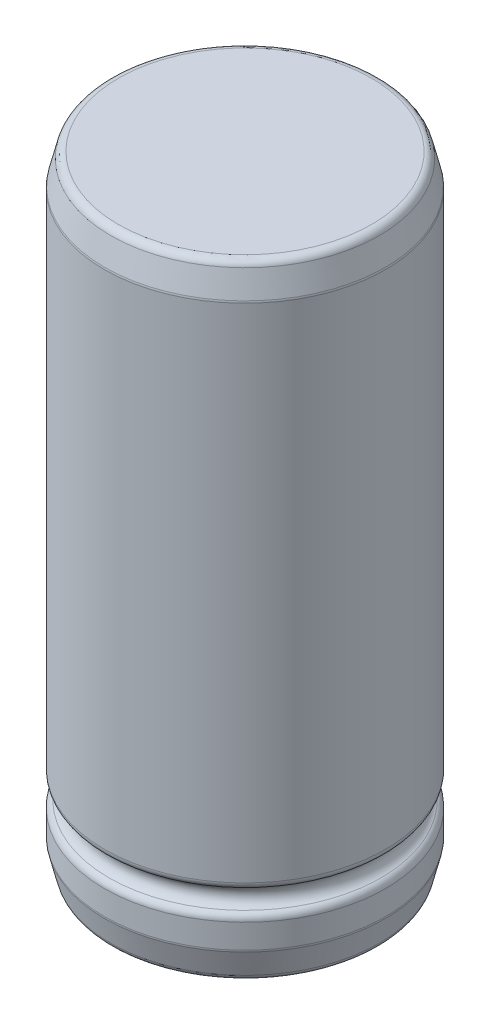
from build123d import *

# Parameters (mm, degrees)
ZAOBLIT1_R                = 0.5
SKICA2_R                  = 0.4
P_IDAT_VYSUNUT_M1_DEPTH   = 3
P_IDAT_VYSUNUT_M1_2_DEPTH = 3


with BuildPart() as part:
    # Skica1 → Rotovat1 (revolve)
    with BuildSketch(Plane.XY, mode=Mode.PRIVATE) as rotovat1_sk:
        with BuildLine():
            Line((0, 40), (8.5, 40))
            Line((8.5, 40), (9, 38))
            Line((9, 38), (9, 5.4))
            ThreePointArc((9, 5.4), (8.3, 4.7), (9, 4))
            Line((9, 4), (9, 2))
            Line((9, 2), (8.5, 0))
            Line((8.5, 0), (0, 0))
            Line((0, 0), (0, 40))
        make_face()
    revolve(rotovat1_sk.sketch.rotate(Axis((0, 0, 0), (0, 1, 0)), 90), axis=Axis((0, 0, 0), (0, 1, 0)))

    # Zaoblit1
    zaoblit1_edges = [part.edges().sort_by_distance(p)[0] for p in [
        (0, 40, 8.5),
        (0, 38, 9),
        (0, 5.4, 9),
        (0, 4, 9),
        (0, 2, 9),
        (0, 0, 8.5),
    ]]
    fillet(zaoblit1_edges, radius=ZAOBLIT1_R)


with BuildPart() as body_2:
    # Skica2 → Přidat vysunutím1 (new body)
    with BuildSketch(Plane.XZ):
        with Locations(Location((-3.75, 0, 0), (0, 0, 270))):
            Circle(SKICA2_R)
    extrude(amount=P_IDAT_VYSUNUT_M1_DEPTH)


with BuildPart() as body_3:
    # Skica2 → P_idat vysunut_m1 2 (new body)
    with BuildSketch(Plane.XZ):
        with Locations(Location((3.75, 0, 0), (0, 0, 270))):
            Circle(SKICA2_R)
    extrude(amount=P_IDAT_VYSUNUT_M1_2_DEPTH)


solid = Compound([part.part, body_2.part, body_3.part])
